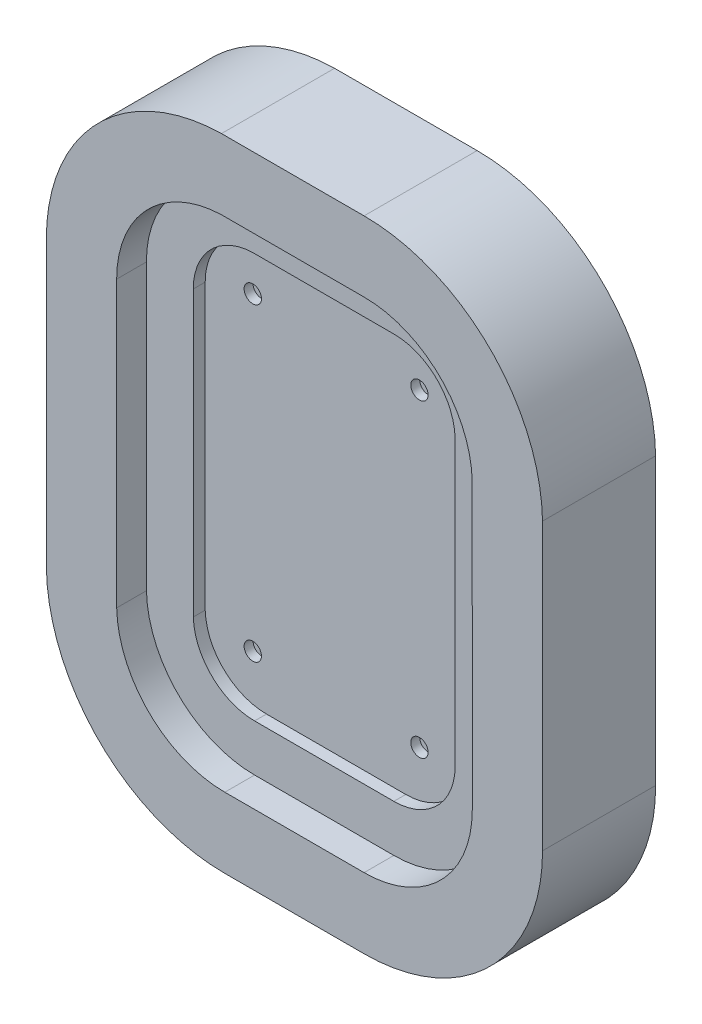
from build123d import *

# Parameters (mm, degrees)
BOSS_EXTRUDE1_START = 2.54
BOSS_EXTRUDE1_DEPTH = 24.13
BOSS_EXTRUDE2_START = -3.81
BOSS_EXTRUDE2_DEPTH = 17.78
BOSS_EXTRUDE3_START = -6.35
BOSS_EXTRUDE3_DEPTH = 15.24
SKETCH6_R           = 1.8499963
CUT_EXTRUDE1_DEPTH  = 1.905


with BuildPart() as part:
    # Sketch3 → Boss-Extrude1 (new body)
    with BuildSketch(Plane.XY.offset(BOSS_EXTRUDE1_START)):
        with BuildLine():
            Line((49.179418991, 71.83051854), (49.183589013, 10.917946581))
            ThreePointArc((49.183589013, 10.917946581), (38.030613987, -16.009405686), (11.103592243, -27.163178684))
            Line((11.103592243, -27.163178684), (-18.610242915, -27.163177904))
            ThreePointArc((-18.610242915, -27.163177904), (-45.28949294, -16.264577298), (-56.692241, 10.203124182))
            Line((-56.692241, 10.203124182), (-56.6964099, 71.109527092))
            ThreePointArc((-56.6964099, 71.109527092), (-45.79864203, 97.789054805), (-19.33135902, 109.192627907))
            Line((-19.33135902, 109.192627907), (11.095154423, 109.196819916))
            ThreePointArc((11.095154423, 109.196819916), (37.775861992, 98.2990136), (49.179418991, 71.83051854))
        make_face()
        with BuildLine():
            ThreePointArc((34.179429779, 71.6724157), (27.226556901, 87.635128483), (11.099100878, 94.196820553))
            Line((11.099100878, 94.196820553), (-19.172523946, 94.192649649))
            ThreePointArc((-19.172523946, 94.192649649), (-35.134735798, 87.239771138), (-41.696410425, 71.112801401))
            Line((-41.696410425, 71.112801401), (-41.692251788, 10.361226959))
            ThreePointArc((-41.692251788, 10.361226959), (-34.73971192, -5.601160899), (-18.612853466, -12.163178358))
            Line((-18.612853466, -12.163178358), (11.103590646, -12.163178684))
            ThreePointArc((11.103590646, -12.163178684), (27.423777198, -5.403039043), (34.183589032, 10.91728329))
            Line((34.183589032, 10.91728329), (34.179429779, 71.6724157))
        make_face(mode=Mode.SUBTRACT)
    extrude(amount=-BOSS_EXTRUDE1_DEPTH)

    # Sketch4 → Boss-Extrude2 (add)
    with BuildSketch(Plane.XY.offset(BOSS_EXTRUDE2_START)):
        with BuildLine():
            Line((-18.612853466, -12.163178358), (11.103590646, -12.163178684))
            ThreePointArc((11.103590646, -12.163178684), (27.423777198, -5.403039043), (34.183589032, 10.91728329))
            Line((34.183589032, 10.91728329), (34.179429779, 71.6724157))
            ThreePointArc((34.179429779, 71.6724157), (27.226556901, 87.635128483), (11.099100878, 94.196820553))
            Line((11.099100878, 94.196820553), (-19.172523946, 94.192649649))
            ThreePointArc((-19.172523946, 94.192649649), (-35.134735798, 87.239771138), (-41.696410425, 71.112801401))
            Line((-41.696410425, 71.112801401), (-41.692251788, 10.361226959))
            ThreePointArc((-41.692251788, 10.361226959), (-34.73971192, -5.601160899), (-18.612853466, -12.163178358))
        make_face()
        with BuildLine():
            Line((-31.696410748, 71.115398672), (-31.692261274, 10.49840121))
            ThreePointArc((-31.692261274, 10.49840121), (-27.7179266, 1.519183246), (-18.615075252, -2.163178586))
            Line((-18.615075252, -2.163178586), (11.103589581, -2.163178687))
            ThreePointArc((11.103589581, -2.163178687), (20.352576379, 1.667895757), (24.183589038, 10.916908147))
            Line((24.183589038, 10.916908147), (24.179439208, 71.535241416))
            ThreePointArc((24.179439208, 71.535241416), (20.205041728, 80.514520126), (11.102078372, 84.196820986))
            Line((11.102078372, 84.196820986), (-19.034923813, 84.1926686))
            ThreePointArc((-19.034923813, 84.1926686), (-28.014111485, 80.21827234), (-31.696410748, 71.115398672))
        make_face(mode=Mode.SUBTRACT)
    extrude(amount=-BOSS_EXTRUDE2_DEPTH)

    # Sketch5 → Boss-Extrude3 (add)
    with BuildSketch(Plane.XY.offset(BOSS_EXTRUDE3_START)):
        with BuildLine():
            Line((-18.615075252, -2.163178586), (11.103589581, -2.163178687))
            ThreePointArc((11.103589581, -2.163178687), (20.352576379, 1.667895757), (24.183589038, 10.916908147))
            Line((24.183589038, 10.916908147), (24.179439208, 71.535241416))
            ThreePointArc((24.179439208, 71.535241416), (20.205041728, 80.514520126), (11.102078372, 84.196820986))
            Line((11.102078372, 84.196820986), (-19.034923813, 84.1926686))
            ThreePointArc((-19.034923813, 84.1926686), (-28.014111485, 80.21827234), (-31.696410748, 71.115398672))
            Line((-31.696410748, 71.115398672), (-31.692261274, 10.49840121))
            ThreePointArc((-31.692261274, 10.49840121), (-27.7179266, 1.519183246), (-18.615075252, -2.163178586))
        make_face()
    extrude(amount=-BOSS_EXTRUDE3_DEPTH)

    # Sketch6 → Cut-Extrude1 (cut)
    with BuildSketch(Plane.XY.offset(-6.35)):
        with Locations((-21.53641096, 74.036821312)):
            Circle(SKETCH6_R)
        with Locations((14.02358904, 74.036821312)):
            Circle(SKETCH6_R)
        with Locations((14.02358904, 7.996821312)):
            Circle(SKETCH6_R)
        with Locations((-21.53641096, 7.996821312)):
            Circle(SKETCH6_R)
    extrude(amount=-CUT_EXTRUDE1_DEPTH, mode=Mode.SUBTRACT)


solid = part.part
